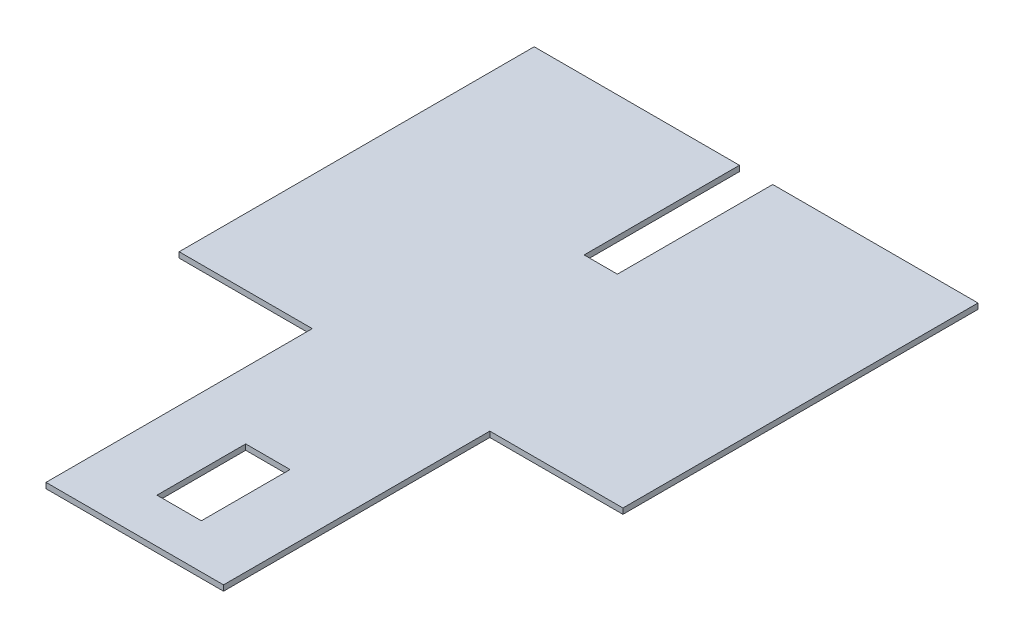
from build123d import *

# Parameters (mm, degrees)
BOSS_EXTRUDE1_DEPTH = 1.5875
CUT_EXTRUDE1_REACH  = 111.261
SKETCH2_W           = 12.7
SKETCH2_H           = 25.4
CUT_EXTRUDE2_REACH  = 111.261
SKETCH3_W           = 9.525
SKETCH3_H           = 44.45


with BuildPart() as part:
    # Sketch1 → Boss-Extrude1 (new body)
    with BuildSketch(Plane(origin=(0, 0, 0), x_dir=(1, 0, 0), z_dir=(0, 1, 0))):
        Polygon((-63.5, -12.7), (-25.4, -12.7), (-25.4, -88.9), (25.4, -88.9), (25.4, -12.7), (63.5, -12.7), (63.5, 88.9), (-63.5, 88.9), align=None)
    extrude(amount=BOSS_EXTRUDE1_DEPTH)

    # Sketch2 → Cut-Extrude1 (cut, up to next)
    with BuildSketch(Plane(origin=(0, 1.5875, 0), x_dir=(1, 0, 0), z_dir=(0, 1, 0)), mode=Mode.PRIVATE) as cut_extrude1_sk1:
        with Locations((0, -63.5)):
            Rectangle(SKETCH2_W, SKETCH2_H)
    cut_extrude1_tool1 = extrude(cut_extrude1_sk1.sketch, amount=-CUT_EXTRUDE1_REACH, mode=Mode.PRIVATE) & part.part
    add(cut_extrude1_tool1.solids().sort_by_distance((0, 1.5875, 63.5))[0], mode=Mode.SUBTRACT)

    # Sketch3 → Cut-Extrude2 (cut, up to next)
    with BuildSketch(Plane(origin=(0, 1.5875, 0), x_dir=(1, 0, 0), z_dir=(0, 1, 0)), mode=Mode.PRIVATE) as cut_extrude2_sk1:
        with Locations((0, 66.675)):
            Rectangle(SKETCH3_W, SKETCH3_H)
    cut_extrude2_tool1 = extrude(cut_extrude2_sk1.sketch, amount=-CUT_EXTRUDE2_REACH, mode=Mode.PRIVATE) & part.part
    add(cut_extrude2_tool1.solids().sort_by_distance((0, 1.5875, -66.675))[0], mode=Mode.SUBTRACT)


solid = part.part
